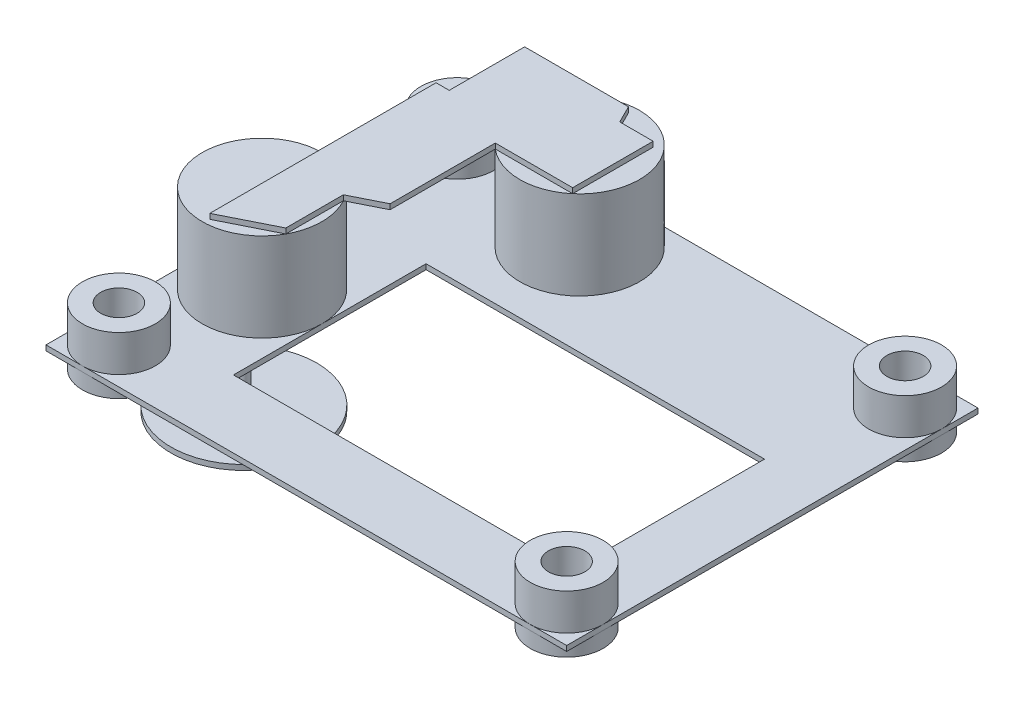
from build123d import *

# Parameters (mm, degrees)
ESQUISSE4_W             = 100
ESQUISSE4_H             = 79
BOSS_EXTRU_3_DEPTH      = 1
BOSS_EXTRU_4_DEPTH      = 7
BOSS_EXTRU_4_DEPTH_BACK = 4
ESQUISSE1_R             = 7
ESQUISSE1_R_2           = 3.5
ESQUISSE6_R             = 11.5
BOSS_EXTRU_5_DEPTH      = 17
BOSS_EXTRU_6_DEPTH      = 1
ESQUISSE8_W             = 65
ESQUISSE8_H             = 37
ENL_V_MAT_EXTRU_1_DEPTH = 1
ESQUISSE9_R             = 1
BOSS_EXTRU_7_DEPTH      = 18
ESQUISSE10_R            = 14
BOSS_EXTRU_8_DEPTH      = 1
ESQUISSE11_R            = 7
BOSS_EXTRU_9_DEPTH      = 2


with BuildPart() as part:
    # Esquisse4 → Boss.-Extru.3 (new body)
    with BuildSketch(Plane(origin=(0, 0, 0), x_dir=(1, 0, 0), z_dir=(0, 1, 0))):
        Rectangle(ESQUISSE4_W, ESQUISSE4_H)
    extrude(amount=-BOSS_EXTRU_3_DEPTH)

    # Esquisse1 → Boss.-Extru.4 (add, two sides: drawn at the far end of the back side and taken through both)
    # profile 1 of 4: a face of its own
    with BuildSketch(Plane(origin=(0, 0, 0), x_dir=(1, 0, 0), z_dir=(0, 1, 0)).offset(-BOSS_EXTRU_4_DEPTH_BACK)):
        with Locations(Location((43, 32.5, 0), (0, 0, 90))):
            Circle(ESQUISSE1_R)
        with Locations(Location((43, 32.5, 0), (0, 0, 90))):
            Circle(ESQUISSE1_R_2, mode=Mode.SUBTRACT)
    # profile 2 of 4: a face of its own
    with BuildSketch(Plane(origin=(0, 0, 0), x_dir=(1, 0, 0), z_dir=(0, 1, 0)).offset(-BOSS_EXTRU_4_DEPTH_BACK)):
        with Locations(Location((-43, 32.5, 0), (0, 0, 90))):
            Circle(ESQUISSE1_R)
        with Locations(Location((-43, 32.5, 0), (0, 0, 90))):
            Circle(ESQUISSE1_R_2, mode=Mode.SUBTRACT)
    # profile 3 of 4: a face of its own
    with BuildSketch(Plane(origin=(0, 0, 0), x_dir=(1, 0, 0), z_dir=(0, 1, 0)).offset(-BOSS_EXTRU_4_DEPTH_BACK)):
        with Locations(Location((-43, -32.5, 0), (0, 0, 270))):
            Circle(ESQUISSE1_R)
        with Locations(Location((-43, -32.5, 0), (0, 0, 90))):
            Circle(ESQUISSE1_R_2, mode=Mode.SUBTRACT)
    # profile 4 of 4: a face of its own
    with BuildSketch(Plane(origin=(0, 0, 0), x_dir=(1, 0, 0), z_dir=(0, 1, 0)).offset(-BOSS_EXTRU_4_DEPTH_BACK)):
        with Locations(Location((43, -32.5, 0), (0, 0, 270))):
            Circle(ESQUISSE1_R)
        with Locations(Location((43, -32.5, 0), (0, 0, 90))):
            Circle(ESQUISSE1_R_2, mode=Mode.SUBTRACT)
    extrude(amount=BOSS_EXTRU_4_DEPTH + BOSS_EXTRU_4_DEPTH_BACK)

    # Esquisse6 → Boss.-Extru.5 (add)
    with BuildSketch(Plane(origin=(0, 0, 0), x_dir=(1, 0, 0), z_dir=(0, 1, 0))):
        with Locations(Location((-38.5, -9.5, 0), (0, 0, 180))):
            Circle(ESQUISSE6_R)
        with Locations(Location((-15, 28, 0), (0, 0, 90))):
            Circle(ESQUISSE6_R)
    extrude(amount=BOSS_EXTRU_5_DEPTH)

    # Esquisse7 → Boss.-Extru.6 (add)
    with BuildSketch(Plane(origin=(0, 17, 0), x_dir=(1, 0, 0), z_dir=(0, 1, 0))):
        Polygon((-38.143774149, -19.88751618), (-28.414215556, -15.025120102), (-28.414215556, -3.974879898), (-22.428299765, -0.98338823), (-22.428299765, 19.221027247), (-7.571700235, 19.221027247), (-7.571700235, 34.680148422), (-13.988712335, 34.680148422), (-15.667356388, 38.039082045), (-35.613243864, 38.039082045), (-35.613243864, 23.559466539), (-38.143774149, 23.559466539), (-38.143774149, 0), align=None)
    extrude(amount=BOSS_EXTRU_6_DEPTH)

    # Esquisse8 → Enlèv. mat.-Extru.1 (cut)
    with BuildSketch(Plane(origin=(0, 0, 0), x_dir=(1, 0, 0), z_dir=(0, 1, 0))):
        with Locations((5.5, -8)):
            Rectangle(ESQUISSE8_W, ESQUISSE8_H)
    extrude(amount=-ENL_V_MAT_EXTRU_1_DEPTH, mode=Mode.SUBTRACT)

    # Esquisse9 → Boss.-Extru.7 (add)
    with BuildSketch(Plane.XZ.offset(1)):
        with Locations(Location((-40, 11.5, 0), (0, 0, 270))):
            Circle(ESQUISSE9_R)
    extrude(amount=BOSS_EXTRU_7_DEPTH)

    # Esquisse10 → Boss.-Extru.8 (add)
    with BuildSketch(Plane.XZ.offset(19)):
        with Locations(Location((-40, 11.5, 0), (0, 0, 270))):
            Circle(ESQUISSE10_R)
    extrude(amount=BOSS_EXTRU_8_DEPTH)

    # Esquisse11 → Boss.-Extru.9 (add)
    with BuildSketch(Plane(origin=(0, -20, 0), x_dir=(-1, 0, 0), z_dir=(0, -1, 0))):
        with Locations(Location((40, -11.5, 0), (0, 0, 90))):
            Circle(ESQUISSE11_R)
    extrude(amount=BOSS_EXTRU_9_DEPTH)


solid = part.part
